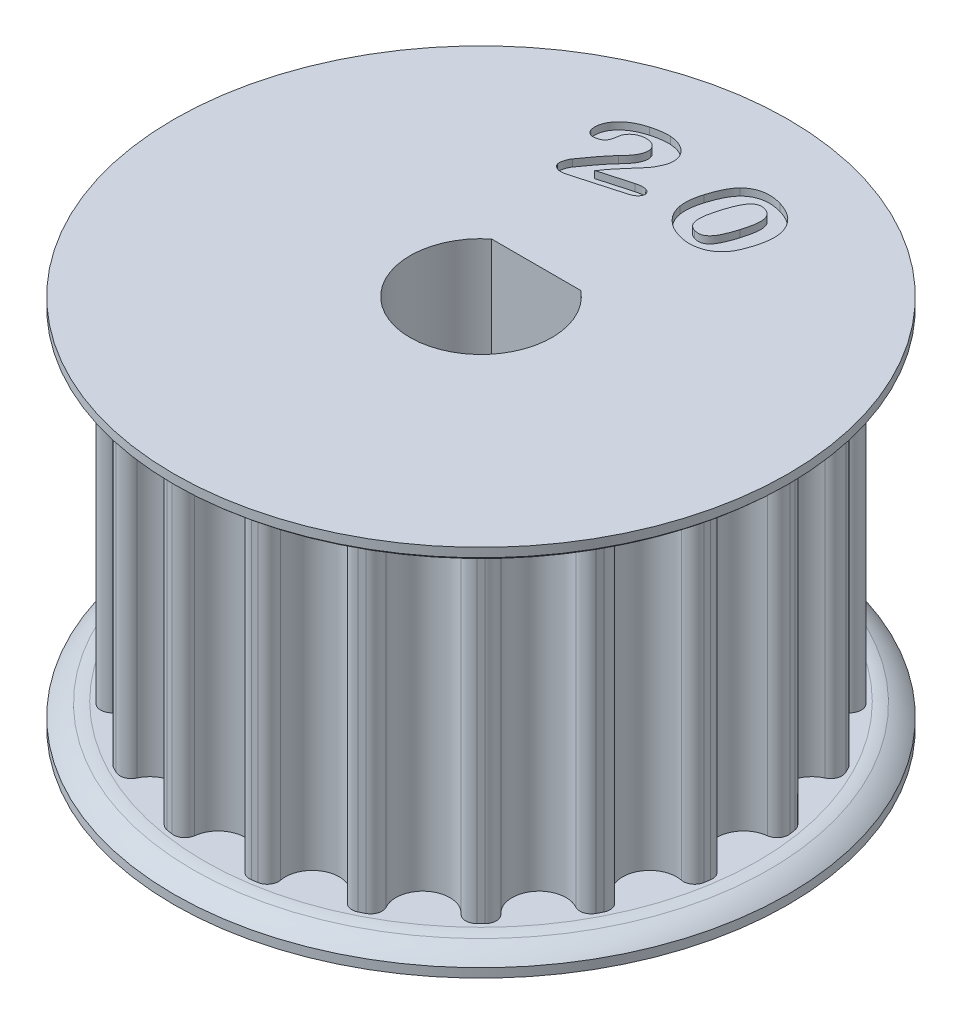
from build123d import *

# Parameters (mm, degrees)
SKETCH1_R               = 15.34399401
TOOTHOD_DEPTH           = 9.2456
TOOTHPROFILE_DEPTH      = 29.509661201
TOOTHPATTERN_COUNT      = 20
BORE_DEPTH              = 27.646251914
BORE_DEPTH_BACK         = 27.646251914
SKETCH7_R               = 4
LARGE_TOOTH_COUNT_DEPTH = 0.4
BOSS_EXTRUDE1_DEPTH     = 21.0312
SKETCH11_R              = 11.1125
CUT_EXTRUDE1_DEPTH      = 2.54


with BuildPart() as part:
    # Sketch1 → ToothOD (new, symmetric)
    with BuildSketch(Plane(origin=(0, 0, 0), x_dir=(1, 0, 0), z_dir=(0, 1, 0))):
        with Locations(Location((0, 0, 0), (0, 0, 270))):
            Circle(SKETCH1_R)
    extrude(amount=TOOTHOD_DEPTH, both=True)

    # Sketch2 → ToothProfile (cut, through all)
    with BuildSketch(Plane(origin=(0, 9.2456, 0), x_dir=(1, 0, 0), z_dir=(0, 1, 0))):
        with BuildLine():
            ThreePointArc((-1.514151189, 14.627414336), (0, 13.28399401), (1.514151189, 14.627414336))
            ThreePointArc((1.514151189, 14.627414336), (1.759047929, 15.056333772), (2.237219512, 15.180019797))
            ThreePointArc((2.237219512, 15.180019797), (0, 15.34399401), (-2.237219512, 15.180019797))
            ThreePointArc((-2.237219512, 15.180019797), (-1.759047929, 15.056333772), (-1.514151189, 14.627414336))
        make_face()
    toothprofile = extrude(amount=-TOOTHPROFILE_DEPTH, mode=Mode.SUBTRACT)

    # ToothPattern: ToothProfile ×20 about axis
    toothpattern_axis = Axis((0, 0, 0), (0, 1, 0))
    for i in range(1, TOOTHPATTERN_COUNT):
        add(toothprofile.rotate(toothpattern_axis, i * 360 / TOOTHPATTERN_COUNT), mode=Mode.SUBTRACT)

    # Sketch4 → Flange (revolve)
    with BuildSketch(Plane.XY, mode=Mode.PRIVATE) as flange_sk:
        with BuildLine():
            Line((0, -9.2456), (15.59799401, -9.2456))
            ThreePointArc((15.59799401, -9.2456), (15.92375, -9.271222571), (16.243566338, -9.338237424))
            ThreePointArc((16.243566338, -9.338237424), (16.811294915, -9.619797125), (17.31249401, -10.0076))
            Line((17.31249401, -10.0076), (17.31249401, -10.5156))
            Line((17.31249401, -10.5156), (0, -10.5156))
            Line((0, -10.5156), (0, -9.2456))
        make_face()
        with BuildLine():
            Line((17.31249401, 10.5156), (17.31249401, 10.0076))
            ThreePointArc((17.31249401, 10.0076), (16.811294915, 9.619797125), (16.243566338, 9.338237424))
            ThreePointArc((16.243566338, 9.338237424), (15.92375, 9.271222571), (15.59799401, 9.2456))
            Line((15.59799401, 9.2456), (0, 9.2456))
            Line((0, 9.2456), (0, 10.5156))
            Line((0, 10.5156), (17.31249401, 10.5156))
        make_face()
    revolve(flange_sk.sketch.rotate(Axis((0, 12.09802, 0), (0, -1, 0)), 90), axis=Axis((0, 12.09802, 0), (0, -1, 0)))

    # Sketch7 → Bore (cut, two sides: drawn at the far end of the back side and taken through both)
    with BuildSketch(Plane.XZ.offset(-BORE_DEPTH_BACK)):
        with Locations(Location((0, 0, 0), (0, 0, 270))):
            Circle(SKETCH7_R)
    extrude(amount=BORE_DEPTH + BORE_DEPTH_BACK, mode=Mode.SUBTRACT)

    # Sketch9 → Large Tooth Count (cut)
    # profile 1 of 2: a face of its own
    with BuildSketch(Plane(origin=(0, 10.5156, 0), x_dir=(1, 0, 0), z_dir=(0, 1, 0))):
        with BuildLine():
            Line((-2.954146893, 9.361462675), (-1.175353143, 9.862418144))
            add(Edge.make_bspline(
                [(-1.175353143, 9.862418144), (-1.123805554, 9.875802418), (-1.026048459, 9.901184938), (-0.883304523, 9.919166454), (-0.754108312, 9.920384436), (-0.63935479, 9.903206029), (-0.541555305, 9.870084112), (-0.462297286, 9.823371078), (-0.402653568, 9.761037925), (-0.383751751, 9.709454292), (-0.374360174, 9.683824394)],
                knots=[0, 0, 0, 0, 1.416600478, 2.686502891, 3.819686855, 4.846312523, 5.7610532, 6.550671378, 7.279885059, 8, 8, 8, 8], degree=3))
            add(Edge.make_bspline(
                [(-0.374360174, 9.683824394), (-0.369719108, 9.660087819), (-0.360266106, 9.611740771), (-0.371972129, 9.535402151), (-0.403229262, 9.458544917), (-0.453267189, 9.380882786), (-0.526096867, 9.307089619), (-0.62160342, 9.241903313), (-0.739824812, 9.186663473), (-0.827592685, 9.159151), (-0.874422674, 9.144471269)],
                knots=[0, 0, 0, 0, 0.710365878, 1.446884956, 2.24079361, 3.150954831, 4.15871712, 5.283676882, 6.550661213, 8, 8, 8, 8], degree=3))
            Line((-0.874422674, 9.144471269), (-3.564937518, 8.387233769))
            add(Edge.make_bspline(
                [(-3.564937518, 8.387233769), (-3.61171521, 8.37543609), (-3.700837127, 8.352958886), (-3.832442975, 8.342282282), (-3.953746135, 8.349940914), (-4.062486177, 8.379695319), (-4.157127763, 8.424314562), (-4.233382296, 8.48426447), (-4.291165156, 8.557997927), (-4.311755017, 8.615372811), (-4.322175018, 8.644408769)],
                knots=[0, 0, 0, 0, 1.301754116, 2.480131396, 3.552996869, 4.569626462, 5.508600737, 6.361601131, 7.170848347, 8, 8, 8, 8], degree=3))
            add(Edge.make_bspline(
                [(-4.322175018, 8.644408769), (-4.326580812, 8.665164293), (-4.336073853, 8.709885638), (-4.332624611, 8.784411615), (-4.322455052, 8.869128107), (-4.299543845, 8.961161902), (-4.27034487, 9.054523865), (-4.235617728, 9.143365747), (-4.1961476, 9.224365129), (-4.163762464, 9.272780303), (-4.148046112, 9.296275956)],
                knots=[0, 0, 0, 0, 0.735191842, 1.58409722, 2.57532651, 3.702715511, 4.874795235, 5.976270416, 7.017893645, 8, 8, 8, 8], degree=3))
            add(Edge.make_bspline(
                [(-4.148046112, 9.296275956), (-4.087211058, 9.382429832), (-3.969092279, 9.549708234), (-3.794337723, 9.790740454), (-3.627134069, 10.014150132), (-3.493100044, 10.188605296), (-3.391151145, 10.317214682), (-3.321382624, 10.403735091), (-3.257675155, 10.482773388), (-3.197071967, 10.55186435), (-3.144281079, 10.614722485), (-3.095438484, 10.668632161), (-3.052483765, 10.714698958), (-3.024770261, 10.742069301), (-3.012189862, 10.754493925)],
                knots=[0, 0, 0, 0, 2.052272746, 3.984741291, 5.793026345, 7.482136723, 8.265501849, 8.986445627, 9.645011633, 10.240581551, 10.774583818, 11.242129634, 11.655968724, 12, 12, 12, 12], degree=3))
            add(Edge.make_bspline(
                [(-3.012189862, 10.754493925), (-2.97279762, 10.794299168), (-2.896763622, 10.871130331), (-2.792806568, 10.988869332), (-2.701039663, 11.102694717), (-2.620574498, 11.212717556), (-2.553383732, 11.320286413), (-2.497592916, 11.424476859), (-2.454002898, 11.526306534), (-2.422746917, 11.625053273), (-2.402709489, 11.71988848), (-2.394004008, 11.810101015), (-2.397937406, 11.895345873), (-2.409888983, 11.949103964), (-2.415686737, 11.975182206)],
                knots=[0, 0, 0, 0, 1.423552018, 2.747707314, 3.991028065, 5.139956742, 6.210844286, 7.212885815, 8.141975106, 9.022746377, 9.842005735, 10.601823445, 11.321739559, 12, 12, 12, 12], degree=3))
            add(Edge.make_bspline(
                [(-2.415686737, 11.975182206), (-2.42429087, 12.001758675), (-2.441249197, 12.0541396), (-2.482578582, 12.125664714), (-2.535327991, 12.18909487), (-2.598872825, 12.244238856), (-2.671873029, 12.2906639), (-2.752660218, 12.328719573), (-2.842148698, 12.355153399), (-2.938047159, 12.37159083), (-3.038305704, 12.378979246), (-3.141121707, 12.374657925), (-3.245814936, 12.36229657), (-3.314774119, 12.344214881), (-3.349732049, 12.335048613)],
                knots=[0, 0, 0, 0, 0.90254133, 1.778864972, 2.655082592, 3.563625712, 4.491394034, 5.448683676, 6.445761391, 7.502723384, 8.594618504, 9.694102356, 10.831056182, 12, 12, 12, 12], degree=3))
            add(Edge.make_bspline(
                [(-3.349732049, 12.335048613), (-3.382418939, 12.324700344), (-3.446620887, 12.304374794), (-3.537125411, 12.263067652), (-3.620087769, 12.213267396), (-3.696565155, 12.156329349), (-3.765107736, 12.089722279), (-3.824340499, 12.013694183), (-3.879435722, 11.931578737), (-3.907718253, 11.87113381), (-3.922125018, 11.840343925)],
                knots=[0, 0, 0, 0, 1.049930399, 2.062220621, 3.039893766, 4.010392484, 4.977929152, 5.957982101, 6.959821796, 8, 8, 8, 8], degree=3))
            add(Edge.make_bspline(
                [(-3.922125018, 11.840343925), (-3.924346544, 11.832933466), (-3.931168204, 11.810178107), (-3.937056605, 11.762522536), (-3.950091222, 11.690823835), (-3.961933852, 11.598900745), (-3.979992527, 11.497578612), (-4.007626887, 11.398655278), (-4.042740729, 11.30637416), (-4.085519388, 11.220216479), (-4.144929258, 11.141703059), (-4.227777014, 11.077150199), (-4.330942518, 11.022005189), (-4.409730011, 10.997774061), (-4.451655487, 10.984879863)],
                knots=[0, 0, 0, 0, 0.255495149, 0.784551133, 1.582182714, 2.666380175, 3.847664823, 4.981851255, 6.056538028, 7.108499466, 8.153764709, 9.280368537, 10.552792622, 12, 12, 12, 12], degree=3))
            add(Edge.make_bspline(
                [(-4.451655487, 10.984879863), (-4.484518593, 10.977014405), (-4.548160913, 10.961782248), (-4.644496368, 10.956258535), (-4.73670461, 10.966954595), (-4.82346759, 10.993238394), (-4.901057808, 11.035922061), (-4.965744414, 11.095093645), (-5.016154224, 11.169717324), (-5.035502925, 11.227460955), (-5.045479705, 11.257235331)],
                knots=[0, 0, 0, 0, 1.104655038, 2.139262494, 3.14009217, 4.129518318, 5.089274639, 6.013546725, 6.975724119, 8, 8, 8, 8], degree=3))
            add(Edge.make_bspline(
                [(-5.045479705, 11.257235331), (-5.05397104, 11.293084372), (-5.071349422, 11.366453082), (-5.077754738, 11.481958813), (-5.072725552, 11.603249079), (-5.051844202, 11.729081667), (-5.016292017, 11.857336166), (-4.964770167, 11.985211731), (-4.897422878, 12.111016582), (-4.814660026, 12.23509846), (-4.715205717, 12.356092866), (-4.597286749, 12.47195975), (-4.46284857, 12.584034957), (-4.31031455, 12.689978389), (-4.14049305, 12.79094259), (-3.950695814, 12.87981994), (-3.743341884, 12.961365981), (-3.596866185, 13.004705712), (-3.521182049, 13.027099394)],
                knots=[0, 0, 0, 0, 0.684205447, 1.400296104, 2.14308195, 2.939673375, 3.767285031, 4.614614734, 5.499007285, 6.417452817, 7.385287256, 8.407291256, 9.488547988, 10.637669497, 11.859015001, 13.159415024, 14.532266988, 16, 16, 16, 16], degree=3))
            add(Edge.make_bspline(
                [(-3.521182049, 13.027099394), (-3.4736299, 13.03988753), (-3.380335158, 13.064977161), (-3.241544955, 13.097089226), (-3.107026771, 13.124112364), (-2.976265984, 13.14490228), (-2.8495897, 13.158917372), (-2.727192142, 13.168269746), (-2.608850533, 13.171070654), (-2.531470246, 13.16854091), (-2.493375018, 13.167295488)],
                knots=[0, 0, 0, 0, 1.134348345, 2.225530054, 3.281228752, 4.294749574, 5.274655805, 6.216612838, 7.122017479, 8, 8, 8, 8], degree=3))
            add(Edge.make_bspline(
                [(-2.493375018, 13.167295488), (-2.439709954, 13.16272022), (-2.334541326, 13.153753966), (-2.181332224, 13.127305431), (-2.036981563, 13.087440761), (-1.901006644, 13.037993111), (-1.775042238, 12.977076771), (-1.658865503, 12.907098719), (-1.552797444, 12.827923999), (-1.459758972, 12.738048259), (-1.376703421, 12.643511102), (-1.309975797, 12.541360057), (-1.254518112, 12.43604159), (-1.230849347, 12.361372234), (-1.219108612, 12.324332988)],
                knots=[0, 0, 0, 0, 1.190830805, 2.333697818, 3.432410255, 4.498757827, 5.529248872, 6.521607877, 7.494563189, 8.449082834, 9.378017597, 10.270819197, 11.142251172, 12, 12, 12, 12], degree=3))
            add(Edge.make_bspline(
                [(-1.219108612, 12.324332988), (-1.211383801, 12.294688493), (-1.195989155, 12.235610479), (-1.183332882, 12.145192252), (-1.176603551, 12.054774787), (-1.178486449, 11.963899215), (-1.188610174, 11.872881101), (-1.205430531, 11.781423706), (-1.230525716, 11.690002431), (-1.274849659, 11.570781829), (-1.33741533, 11.429640428), (-1.41591175, 11.271086939), (-1.50151055, 11.130952631), (-1.579521706, 11.024672795), (-1.647287016, 10.941396881), (-1.706925628, 10.872235184), (-1.772228142, 10.792201909), (-1.847731998, 10.704799598), (-1.931711291, 10.608913676), (-2.022333861, 10.502919779), (-2.123153923, 10.389883416), (-2.227945717, 10.269423426), (-2.334199707, 10.149850826), (-2.432223405, 10.033064938), (-2.522427016, 9.924904713), (-2.603216232, 9.823238211), (-2.675411176, 9.729477266), (-2.73794607, 9.642126083), (-2.79312732, 9.563443557), (-2.824329241, 9.511648282), (-2.838953924, 9.487371269)],
                knots=[0, 0, 0, 0, 0.759348993, 1.513293812, 2.260847921, 3.006759253, 3.764275153, 4.530379131, 5.311389733, 6.112558984, 7.683247224, 9.139506665, 10.498308862, 11.750708933, 12.406871982, 13.161322828, 14.015965315, 14.96902083, 16.02622199, 17.177907503, 18.428216246, 19.783402464, 21.138588682, 22.396006758, 23.565473171, 24.632146706, 25.617187237, 26.500440687, 27.297140101, 28, 28, 28, 28], degree=3))
            add(Edge.make_bspline(
                [(-2.838953924, 9.487371269), (-2.855289837, 9.463900755), (-2.888073876, 9.416798504), (-2.932072354, 9.379949994), (-2.954146893, 9.361462675)],
                knots=[0, 0, 0, 0, 0.996577163, 2, 2, 2, 2], degree=3))
        make_face()
    # profile 2 of 2: a face of its own
    with BuildSketch(Plane(origin=(0, 10.5156, 0), x_dir=(1, 0, 0), z_dir=(0, 1, 0))):
        with BuildLine():
            add(Edge.make_bspline(
                [(5.214409045, 10.150130338), (5.190714867, 10.074880459), (5.1449507, 9.929538937), (5.067123561, 9.722992573), (4.985074358, 9.534662094), (4.897683151, 9.362490125), (4.797990216, 9.204699763), (4.68207819, 9.059315083), (4.548391417, 8.924355594), (4.448207144, 8.844811647), (4.397342639, 8.804426432)],
                knots=[0, 0, 0, 0, 1.18011728, 2.279339777, 3.300312696, 4.252335004, 5.165279864, 6.087474786, 7.028992811, 8, 8, 8, 8], degree=3))
            add(Edge.make_bspline(
                [(4.397342639, 8.804426432), (4.368452389, 8.783759012), (4.310444351, 8.742261398), (4.218090567, 8.68760354), (4.122567032, 8.636381907), (4.021053968, 8.594804769), (3.917071626, 8.55542857), (3.807864453, 8.524522636), (3.694856927, 8.498897601), (3.578149786, 8.477916033), (3.458784674, 8.465052918), (3.337809148, 8.457659325), (3.215789514, 8.457269131), (3.092816601, 8.466425015), (2.968336345, 8.478893397), (2.842901635, 8.500737733), (2.716334551, 8.529457806), (2.632441476, 8.553128463), (2.589973889, 8.565110807)],
                knots=[0, 0, 0, 0, 0.901536881, 1.810174201, 2.722951407, 3.650873295, 4.592999596, 5.545017892, 6.529601249, 7.5348545, 8.553963068, 9.576094043, 10.611551205, 11.649240286, 12.705913058, 13.786930103, 14.879719961, 16, 16, 16, 16], degree=3))
            add(Edge.make_bspline(
                [(2.589973889, 8.565110807), (2.543632445, 8.579700214), (2.452042396, 8.608534977), (2.319678008, 8.661606647), (2.193694452, 8.721556974), (2.07328836, 8.787716416), (1.959122861, 8.861323411), (1.84975651, 8.940228266), (1.747631416, 9.027720056), (1.651608943, 9.121077228), (1.562444683, 9.219388851), (1.482907007, 9.322900319), (1.410803045, 9.429205404), (1.348352462, 9.54012966), (1.294619283, 9.655154495), (1.248761777, 9.773672505), (1.213020235, 9.896616587), (1.195786369, 9.980335913), (1.187119983, 10.022435807)],
                knots=[0, 0, 0, 0, 1.093974974, 2.162151445, 3.208754958, 4.235018977, 5.254163096, 6.266603484, 7.270125483, 8.279987647, 9.281626696, 10.256545703, 11.217884655, 12.172537706, 13.120291723, 14.075274297, 15.032114198, 16, 16, 16, 16], degree=3))
            add(Edge.make_bspline(
                [(1.187119983, 10.022435807), (1.180867164, 10.069996862), (1.168240345, 10.166040708), (1.1601745, 10.312869392), (1.163621366, 10.463459377), (1.174789304, 10.6179706), (1.197160825, 10.776345136), (1.22609065, 10.938288092), (1.264806684, 11.103647427), (1.296751927, 11.213792398), (1.313028577, 11.26991315)],
                knots=[0, 0, 0, 0, 0.910485463, 1.838616153, 2.788107085, 3.768457025, 4.77780678, 5.823027201, 6.890795017, 8, 8, 8, 8], degree=3))
            add(Edge.make_bspline(
                [(1.313028577, 11.26991315), (1.33538935, 11.341535758), (1.379078841, 11.481475247), (1.452154195, 11.682542865), (1.529127683, 11.87032368), (1.609998022, 12.044290335), (1.6952769, 12.205137541), (1.787378592, 12.350429447), (1.883615047, 12.482465752), (1.954403412, 12.561103972), (1.98900592, 12.599543619)],
                knots=[0, 0, 0, 0, 1.196779593, 2.338322093, 3.411423727, 4.433178792, 5.397622731, 6.313149774, 7.175440056, 8, 8, 8, 8], degree=3))
            add(Edge.make_bspline(
                [(1.98900592, 12.599543619), (2.018628391, 12.628603845), (2.077103584, 12.685969161), (2.171791495, 12.762895464), (2.270271079, 12.832357217), (2.373785475, 12.892330016), (2.480624357, 12.946184702), (2.592696711, 12.989493011), (2.708793143, 13.025239338), (2.829056329, 13.052964555), (2.952560802, 13.072627552), (3.079412612, 13.083143097), (3.208835866, 13.085694737), (3.341290865, 13.080548732), (3.476299628, 13.065774952), (3.61437117, 13.043471927), (3.75507657, 13.012338384), (3.848891552, 12.985499356), (3.89638717, 12.971911588)],
                knots=[0, 0, 0, 0, 0.971271056, 1.917303395, 2.853215794, 3.790451001, 4.716264034, 5.652098562, 6.6001573, 7.558841376, 8.539768638, 9.526129073, 10.537034007, 11.569480832, 12.627883147, 13.715356414, 14.843355738, 16, 16, 16, 16], degree=3))
            add(Edge.make_bspline(
                [(3.89638717, 12.971911588), (3.961047138, 12.951501287), (4.087573261, 12.911562568), (4.26784755, 12.835416509), (4.436188729, 12.750440953), (4.590932452, 12.653297499), (4.733128735, 12.548330058), (4.861794309, 12.434592971), (4.975915242, 12.311534463), (5.075655196, 12.180079229), (5.162485109, 12.042696768), (5.235003627, 11.900099386), (5.294184558, 11.753211843), (5.321379679, 11.651830378), (5.334959827, 11.601204557)],
                knots=[0, 0, 0, 0, 1.170483588, 2.290393202, 3.375582303, 4.424020791, 5.441917151, 6.425119279, 7.385477153, 8.335528901, 9.2711732, 10.18851884, 11.095419263, 12, 12, 12, 12], degree=3))
            add(Edge.make_bspline(
                [(5.334959827, 11.601204557), (5.345438057, 11.551051125), (5.366875769, 11.448440786), (5.381402987, 11.288093713), (5.386496657, 11.119523422), (5.37668279, 10.94229087), (5.355085027, 10.756243659), (5.320633311, 10.561374709), (5.274470628, 10.357721475), (5.234765054, 10.220486907), (5.214409045, 10.150130338)],
                knots=[0, 0, 0, 0, 0.834578345, 1.707487665, 2.620008346, 3.581952147, 4.597888727, 5.671599988, 6.806290297, 8, 8, 8, 8], degree=3))
        make_face()
        with BuildLine():
            add(Edge.make_bspline(
                [(4.031225452, 10.56982565), (4.04357031, 10.611754452), (4.067764283, 10.693928279), (4.100757692, 10.814739321), (4.129381589, 10.930615781), (4.154607751, 11.040966004), (4.17517115, 11.146384723), (4.191469661, 11.246428339), (4.20286392, 11.341205651), (4.213841097, 11.457443534), (4.216752136, 11.592054856), (4.202110036, 11.740591906), (4.171074433, 11.872605872), (4.127424694, 11.969388232), (4.083881673, 12.037912926), (4.045434796, 12.084373108), (4.000776302, 12.126406709), (3.951930174, 12.1663729), (3.895704752, 12.200546592), (3.835309816, 12.2331379), (3.768732382, 12.260690902), (3.722073138, 12.275724197), (3.698148108, 12.283432682)],
                knots=[0, 0, 0, 0, 1.326170746, 2.599085169, 3.799445801, 4.94753492, 6.033295135, 7.057791564, 8.022292309, 8.929082325, 10.600110398, 12.098179301, 13.447489324, 14.696469786, 15.297719383, 15.907121204, 16.520325778, 17.15644649, 17.817961626, 18.512851169, 19.237448412, 20, 20, 20, 20], degree=3))
            add(Edge.make_bspline(
                [(3.698148108, 12.283432682), (3.667653286, 12.291427612), (3.608467335, 12.306944593), (3.518859453, 12.315603473), (3.43228089, 12.313007472), (3.348970179, 12.294162773), (3.268843326, 12.263717987), (3.191916068, 12.219918135), (3.118272519, 12.163156193), (3.048551775, 12.092068958), (2.979738045, 12.008223912), (2.914539397, 11.907932136), (2.848206908, 11.793856803), (2.784246551, 11.663475333), (2.721164908, 11.517923561), (2.658918626, 11.35696549), (2.597074002, 11.180720122), (2.558899013, 11.057224397), (2.53907467, 10.993092838)],
                knots=[0, 0, 0, 0, 0.779608217, 1.513104545, 2.221386719, 2.915408799, 3.617719978, 4.337304937, 5.09957383, 5.912718864, 6.798071582, 7.781475227, 8.871367297, 10.064760717, 11.37536222, 12.799043681, 14.337737445, 16, 16, 16, 16], degree=3))
            add(Edge.make_bspline(
                [(2.53907467, 10.993092838), (2.525780531, 10.948798919), (2.499803053, 10.862246169), (2.465057265, 10.73449515), (2.434565149, 10.612447484), (2.409051423, 10.496192633), (2.385689628, 10.386027538), (2.369510135, 10.280960181), (2.355595424, 10.18190809), (2.343868918, 10.061130514), (2.339639419, 9.922828249), (2.350968028, 9.771566451), (2.3796989, 9.639943096), (2.426133084, 9.526879767), (2.492105714, 9.432454634), (2.5754877, 9.355240728), (2.675763288, 9.292853541), (2.751545994, 9.266420565), (2.790891858, 9.252696744)],
                knots=[0, 0, 0, 0, 1.129632941, 2.207364826, 3.233713364, 4.202180195, 5.114802594, 5.983834708, 6.798254548, 7.557928904, 8.947170659, 10.172937136, 11.254195191, 12.225169878, 13.138921205, 14.044331844, 14.984630429, 16, 16, 16, 16], degree=3))
            add(Edge.make_bspline(
                [(2.790891858, 9.252696744), (2.81520806, 9.24606045), (2.862572058, 9.233134031), (2.933678635, 9.220591584), (3.00207604, 9.214307045), (3.068211057, 9.213853312), (3.131658175, 9.221202469), (3.192706609, 9.234608636), (3.251390292, 9.254092676), (3.326480383, 9.29123363), (3.417640784, 9.352659395), (3.517714155, 9.450500325), (3.613187275, 9.570539223), (3.684054974, 9.688732373), (3.739933925, 9.794808606), (3.782672042, 9.883814369), (3.824376633, 9.980554467), (3.866377238, 10.084159167), (3.908185032, 10.194975421), (3.950511202, 10.312951239), (3.99116818, 10.438835364), (4.017651783, 10.525438733), (4.031225452, 10.56982565)],
                knots=[0, 0, 0, 0, 0.740928597, 1.443208135, 2.119986108, 2.75897178, 3.38438367, 3.99391264, 4.594578025, 5.197471523, 6.452606339, 7.808452879, 9.297145185, 10.951528506, 11.852090658, 12.823028486, 13.854016112, 14.949569282, 16.110321297, 17.336804467, 18.635029525, 20, 20, 20, 20], degree=3))
        make_face(mode=Mode.SUBTRACT)
    extrude(amount=-LARGE_TOOTH_COUNT_DEPTH, mode=Mode.SUBTRACT)

    # Sketch10 → Boss-Extrude1 (add, through all)
    with BuildSketch(Plane.XZ.offset(10.5156)):
        with BuildLine():
            Line((-2.514294931, -3.111), (2.514294931, -3.111))
            ThreePointArc((2.514294931, -3.111), (0, -4), (-2.514294931, -3.111))
        make_face()
    extrude(amount=-BOSS_EXTRUDE1_DEPTH)

    # Sketch11 → Cut-Extrude1 (cut)
    with BuildSketch(Plane.XZ.offset(10.5156)):
        with Locations(Location((0, 0, 0), (0, 0, 270))):
            Circle(SKETCH11_R)
    extrude(amount=-CUT_EXTRUDE1_DEPTH, mode=Mode.SUBTRACT)


solid = part.part
